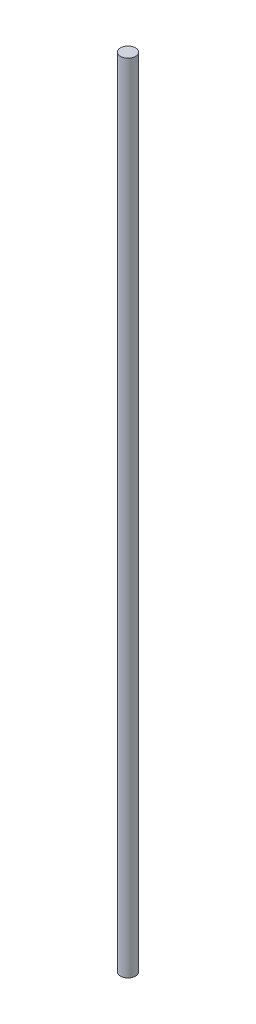
from build123d import *

# Parameters (mm, degrees)
SKETCH1_R           = 1.5
BOSS_EXTRUDE1_DEPTH = 160


with BuildPart() as part:
    # Sketch1 → Boss-Extrude1 (new body)
    with BuildSketch(Plane(origin=(0, 0, 0), x_dir=(1, 0, 0), z_dir=(0, 1, 0))):
        with Locations(Location((0, 0, 0), (0, 0, 270))):
            Circle(SKETCH1_R)
    extrude(amount=BOSS_EXTRUDE1_DEPTH)


solid = part.part
